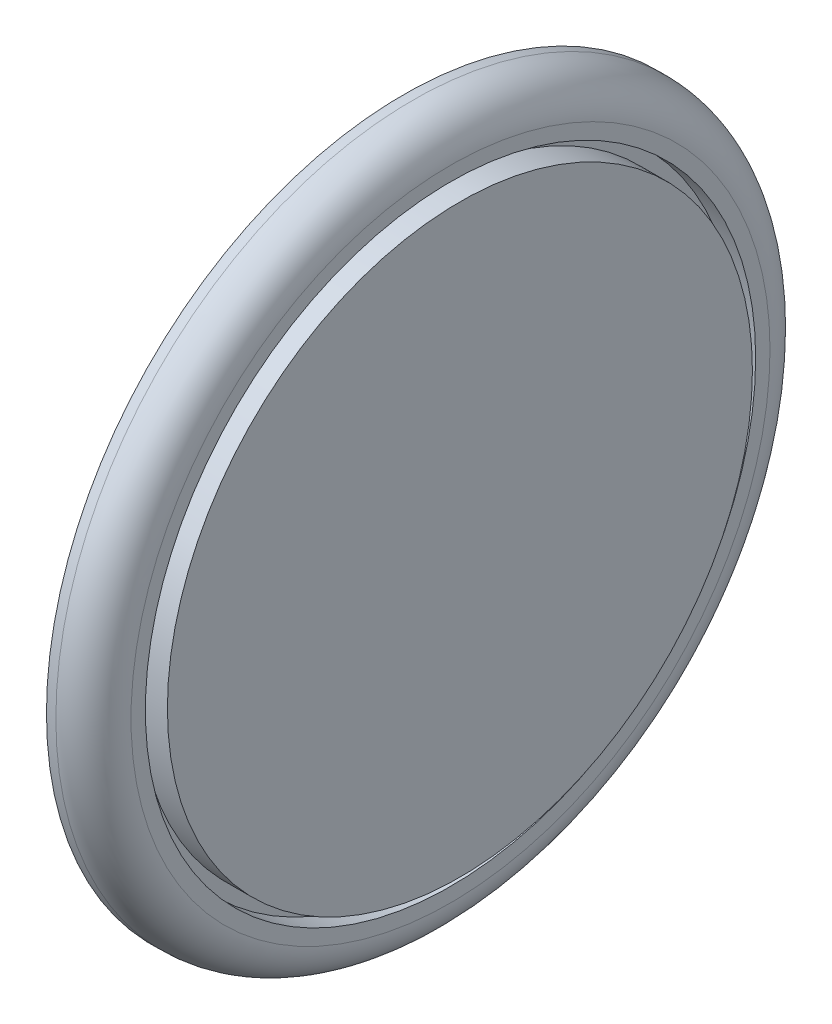
from build123d import *

# Parameters (mm, degrees)
SKETCH1_R           = 38
BOSS_EXTRUDE1_DEPTH = 5
FILLET1_R           = 4
SKETCH2_R           = 2
BOSS_EXTRUDE2_DEPTH = 2.3
SKETCH3_R           = 32.474473425
CUT_EXTRUDE1_DEPTH  = 2
SKETCH4_R           = 35.191697817
SKETCH4_R_2         = 32.740433986
CUT_EXTRUDE2_DEPTH  = 2
SKETCH5_R           = 31.128585578
BOSS_EXTRUDE3_DEPTH = 3


with BuildPart() as part:
    # Sketch1 → Boss-Extrude1 (new body)
    with BuildSketch(Plane(origin=(0, 0, 0), x_dir=(0, 0, -1), z_dir=(1, 0, 0))):
        Circle(SKETCH1_R)
    extrude(amount=BOSS_EXTRUDE1_DEPTH)

    # Fillet1
    fillet1_edges = [part.edges().sort_by_distance(p)[0] for p in [
        (5, 0, 38),
    ]]
    fillet(fillet1_edges, radius=FILLET1_R)

    # Sketch2 → Boss-Extrude2 (add)
    with BuildSketch(Plane.ZY):
        with Locations(Location((0, 0, 0), (0, 0, 180))):
            Circle(SKETCH2_R)
        with Locations(Location((0, 16.29, 0), (0, 0, 180))):
            Circle(SKETCH2_R)
        with Locations(Location((16.29, 0, 0), (0, 0, 180))):
            Circle(SKETCH2_R)
        with Locations(Location((-16.29, 0, 0), (0, 0, 180))):
            Circle(SKETCH2_R)
        with Locations(Location((0, -16.29, 0), (0, 0, 180))):
            Circle(SKETCH2_R)
    extrude(amount=BOSS_EXTRUDE2_DEPTH)

    # Sketch3 → Cut-Extrude1 (cut)
    with BuildSketch(Plane(origin=(5, 0, 0), x_dir=(0, 0, -1), z_dir=(1, 0, 0))):
        Circle(SKETCH3_R)
    extrude(amount=-CUT_EXTRUDE1_DEPTH, mode=Mode.SUBTRACT)

    # Sketch4 → Cut-Extrude2 (cut)
    with BuildSketch(Plane.ZY):
        Circle(SKETCH4_R)
        Circle(SKETCH4_R_2, mode=Mode.SUBTRACT)
    extrude(amount=-CUT_EXTRUDE2_DEPTH, mode=Mode.SUBTRACT)

    # Sketch5 → Boss-Extrude3 (add)
    with BuildSketch(Plane(origin=(3, 0, 0), x_dir=(0, 0, -1), z_dir=(1, 0, 0))):
        Circle(SKETCH5_R)
    extrude(amount=BOSS_EXTRUDE3_DEPTH)


solid = part.part
